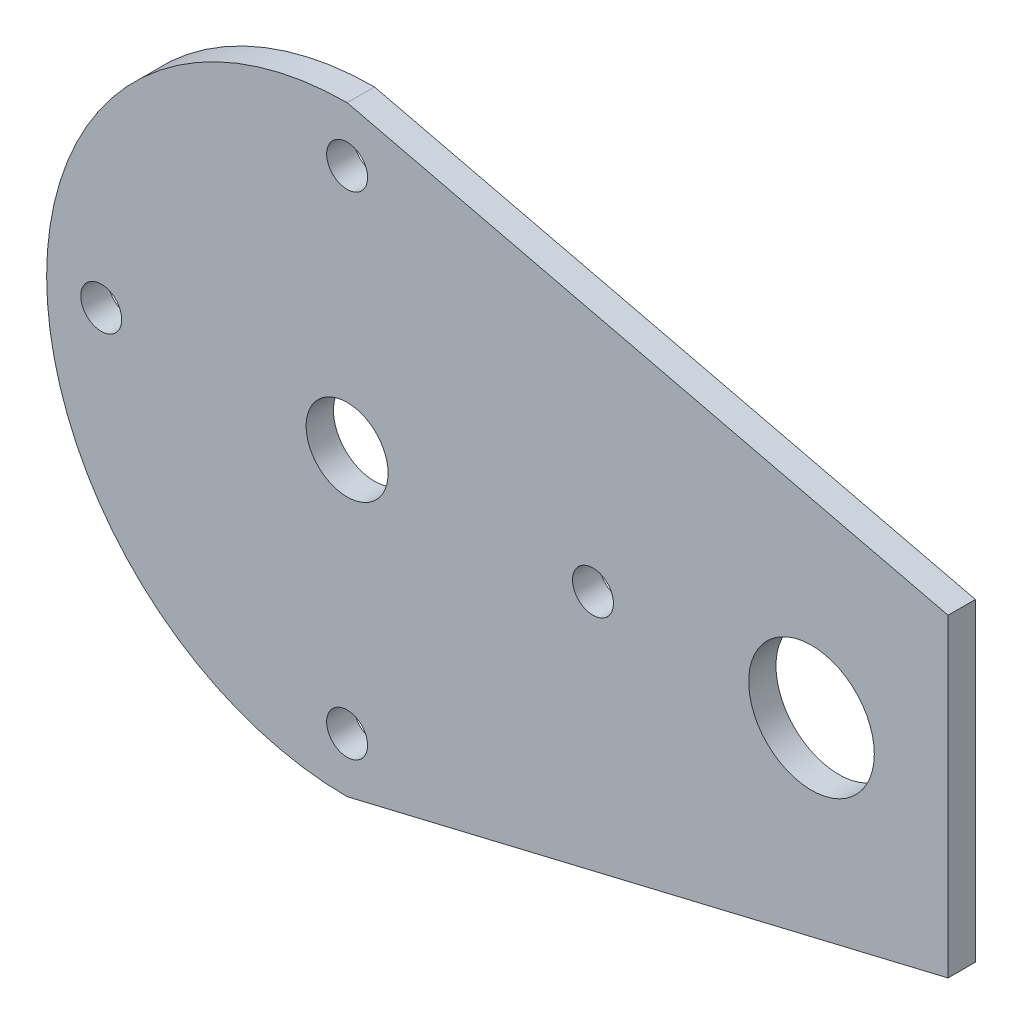
from build123d import *

# Parameters (mm, degrees)
SKETCH_1_R      = 1.5
SKETCH_1_R_2    = 3
SKETCH_1_R_3    = 4.6
EXTRUDE_1_DEPTH = 2


with BuildPart() as part:
    # 草图1 → 凸台-拉伸1 (new body)
    with BuildSketch(Plane.XY):
        with BuildLine():
            Line((5.001004832, -11.501004832), (5.001004832, 11.501004832))
            Line((5.001004832, 11.501004832), (-38.998995168, 22.002009663))
            ThreePointArc((-38.998995168, 22.002009663), (-61.001004832, 0), (-38.998995168, -22.002009663))
            Line((-38.998995168, -22.002009663), (5.001004832, -11.501004832))
        make_face()
        with Locations((-38.998995168, -18.002009663)):
            Circle(SKETCH_1_R, mode=Mode.SUBTRACT)
        with Locations((-57.001004832, 0)):
            Circle(SKETCH_1_R, mode=Mode.SUBTRACT)
        with Locations((-38.998995168, 0)):
            Circle(SKETCH_1_R_2, mode=Mode.SUBTRACT)
        with Locations((-38.998995168, 18.002009663)):
            Circle(SKETCH_1_R, mode=Mode.SUBTRACT)
        with Locations((-20.996985505, 0)):
            Circle(SKETCH_1_R, mode=Mode.SUBTRACT)
        with Locations((-4.998995168, 0)):
            Circle(SKETCH_1_R_3, mode=Mode.SUBTRACT)
    extrude(amount=EXTRUDE_1_DEPTH)


solid = part.part
